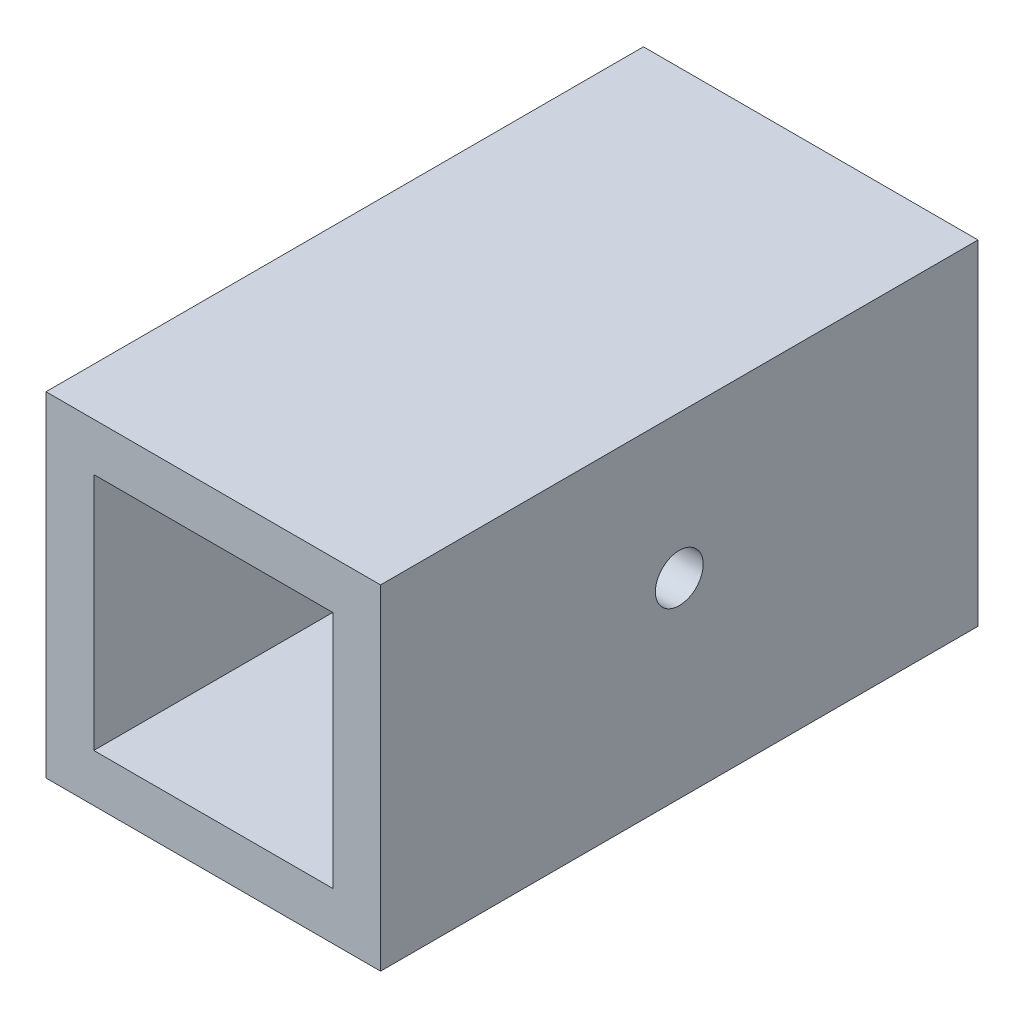
from build123d import *

# Parameters (mm, degrees)
SKETCH_1_W          = 14
SKETCH_1_H          = 14
SKETCH_1_W_2        = 10
SKETCH_1_H_2        = 10
EXTRUDE_1_DEPTH     = 10
SKETCH_2_W          = 14
SKETCH_2_H          = 14
EXTRUDE_2_DEPTH     = 5
SKETCH_3_W          = 14
SKETCH_3_H          = 14
SKETCH_3_W_2        = 10
SKETCH_3_H_2        = 10
EXTRUDE_3_DEPTH     = 10
SKETCH_6_R          = 1
CUT_EXTRUDE_1_DEPTH = 16


with BuildPart() as part:
    # 草图1 → 凸台-拉伸1 (new body)
    with BuildSketch(Plane.XY):
        with Locations((7, 7)):
            Rectangle(SKETCH_1_W, SKETCH_1_H)
        with Locations((7, 7)):
            Rectangle(SKETCH_1_W_2, SKETCH_1_H_2, mode=Mode.SUBTRACT)
    extrude(amount=EXTRUDE_1_DEPTH)

    # 草图2 → 凸台-拉伸2 (add)
    with BuildSketch(Plane.XY.offset(10)):
        with Locations((7, 7)):
            Rectangle(SKETCH_2_W, SKETCH_2_H)
    extrude(amount=EXTRUDE_2_DEPTH)

    # 草图3 → 凸台-拉伸3 (add)
    with BuildSketch(Plane.XY.offset(15)):
        with Locations((7, 7)):
            Rectangle(SKETCH_3_W, SKETCH_3_H)
        with Locations((7, 7)):
            Rectangle(SKETCH_3_W_2, SKETCH_3_H_2, mode=Mode.SUBTRACT)
    extrude(amount=EXTRUDE_3_DEPTH)

    # 草图6 → 切除-拉伸1 (cut)
    with BuildSketch(Plane(origin=(14, 0, 0), x_dir=(0, 0, -1), z_dir=(1, 0, 0))):
        with Locations((-12.5, 8)):
            Circle(SKETCH_6_R)
    extrude(amount=-CUT_EXTRUDE_1_DEPTH, mode=Mode.SUBTRACT)


solid = part.part
